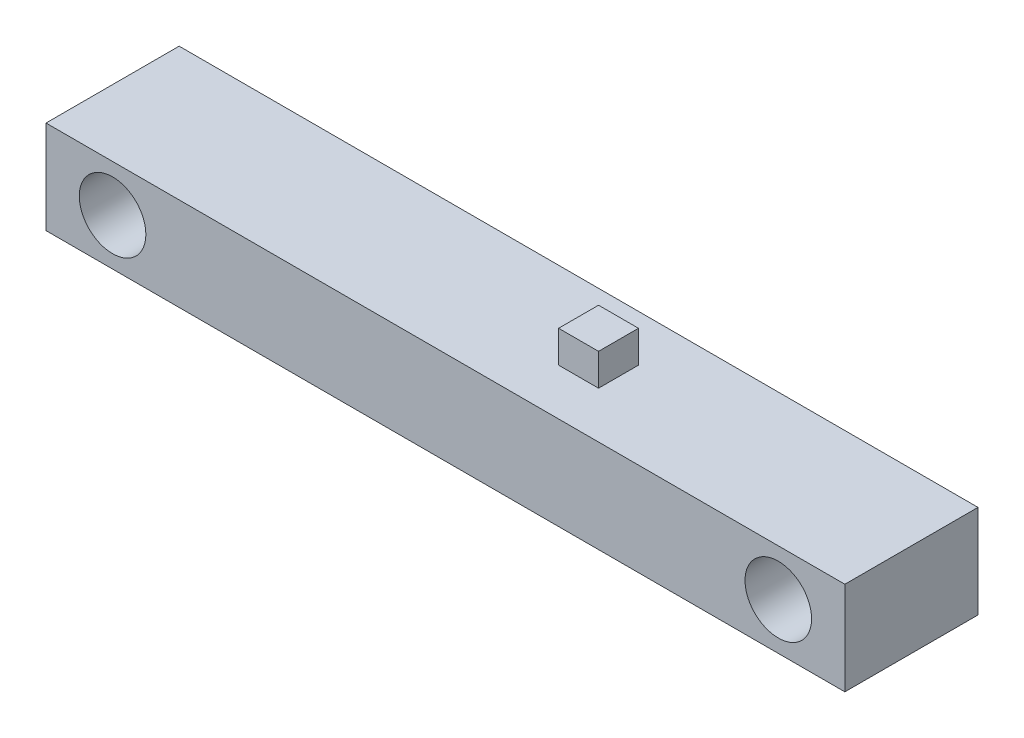
from build123d import *

# Parameters (mm, degrees)
SKETCH1_W           = 300
SKETCH1_H           = 50
BOSS_EXTRUDE1_DEPTH = 35
SKETCH2_W           = 15
SKETCH2_H           = 15
BOSS_EXTRUDE2_DEPTH = 12
CUT_EXTRUDE1_REACH  = 166.952
SKETCH3_R           = 12.5


with BuildPart() as part:
    # Sketch1 → Boss-Extrude1 (new body)
    with BuildSketch(Plane(origin=(0, 0, 0), x_dir=(1, 0, 0), z_dir=(0, 1, 0))):
        with Locations((0, 25)):
            Rectangle(SKETCH1_W, SKETCH1_H)
    extrude(amount=BOSS_EXTRUDE1_DEPTH)

    # Sketch2 → Boss-Extrude2 (add)
    with BuildSketch(Plane(origin=(0, 35, 0), x_dir=(1, 0, 0), z_dir=(0, 1, 0))):
        with Locations((32.5, 25)):
            Rectangle(SKETCH2_W, SKETCH2_H)
    extrude(amount=BOSS_EXTRUDE2_DEPTH)

    # Sketch3 → Cut-Extrude1 (cut, up to next)
    with BuildSketch(Plane.XY, mode=Mode.PRIVATE) as cut_extrude1_sk1:
        with Locations((-125, 17.5)):
            Circle(SKETCH3_R)
    cut_extrude1_tool1 = extrude(cut_extrude1_sk1.sketch, amount=-CUT_EXTRUDE1_REACH, mode=Mode.PRIVATE) & part.part
    # Sketch3 → Cut-Extrude1 (cut, up to next)
    with BuildSketch(Plane.XY, mode=Mode.PRIVATE) as cut_extrude1_sk2:
        with Locations((125, 17.5)):
            Circle(SKETCH3_R)
    cut_extrude1_tool2 = extrude(cut_extrude1_sk2.sketch, amount=-CUT_EXTRUDE1_REACH, mode=Mode.PRIVATE) & part.part
    add(cut_extrude1_tool1.solids().sort_by_distance((-125, 17.5, 0))[0], mode=Mode.SUBTRACT)
    add(cut_extrude1_tool2.solids().sort_by_distance((125, 17.5, 0))[0], mode=Mode.SUBTRACT)


solid = part.part
